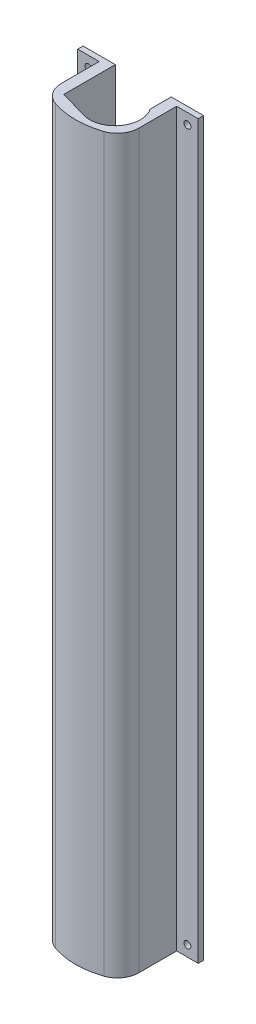
from build123d import *

# Parameters (mm, degrees)
BOSS_EXTRUDE1_DEPTH = 431.8
SKETCH2_R           = 2.032
CUT_EXTRUDE1_DEPTH  = 436.166892099
FILLET2_R           = 12.7


with BuildPart() as part:
    # Sketch1 → Boss-Extrude1 (new body)
    with BuildSketch(Plane(origin=(0, 0, 0), x_dir=(1, 0, 0), z_dir=(0, 1, 0))):
        with BuildLine():
            Line((-20.574, -9.652129604), (-4.162019583, -14.39674322))
            ThreePointArc((-4.162019583, -14.39674322), (12.103082443, -8.837647749), (12.446, 8.347796497))
            Line((12.446, 8.347796497), (12.446, 20.746712887))
            Line((12.446, 20.746712887), (31.496, 20.746712887))
            Line((31.496, 20.746712887), (31.496, 17.571712887))
            Line((31.496, 17.571712887), (18.796, 17.571712887))
            Line((18.796, 17.571712887), (18.796, -12.827129604))
            ThreePointArc((18.796, -12.827129604), (-4.064, -19.155968814), (-26.924, -12.827129604))
            Line((-26.924, -12.827129604), (-26.924, 17.571712887))
            Line((-26.924, 17.571712887), (-39.624, 17.571712887))
            Line((-39.624, 17.571712887), (-39.624, 20.746712887))
            Line((-39.624, 20.746712887), (-20.574, 20.746712887))
            Line((-20.574, 20.746712887), (-20.574, 9.652))
            Line((-20.574, 9.652), (-20.574, -9.652129604))
        make_face()
    extrude(amount=BOSS_EXTRUDE1_DEPTH)

    # Sketch2 → Cut-Extrude1 (cut, through all)
    with BuildSketch(Plane.XY.offset(-17.571712887)):
        with Locations((-33.274, 425.45)):
            Circle(SKETCH2_R)
        with Locations((-33.274, 6.35)):
            Circle(SKETCH2_R)
        with Locations((25.146, 425.45)):
            Circle(SKETCH2_R)
        with Locations((25.146, 6.35)):
            Circle(SKETCH2_R)
    extrude(amount=-CUT_EXTRUDE1_DEPTH, mode=Mode.SUBTRACT)

    # Fillet2
    fillet2_edges = [part.edges().sort_by_distance(p)[0] for p in [
        (18.796, 215.9, 12.827129604),
        (-26.924, 215.9, 12.827129604),
    ]]
    fillet(fillet2_edges, radius=FILLET2_R)


solid = part.part
